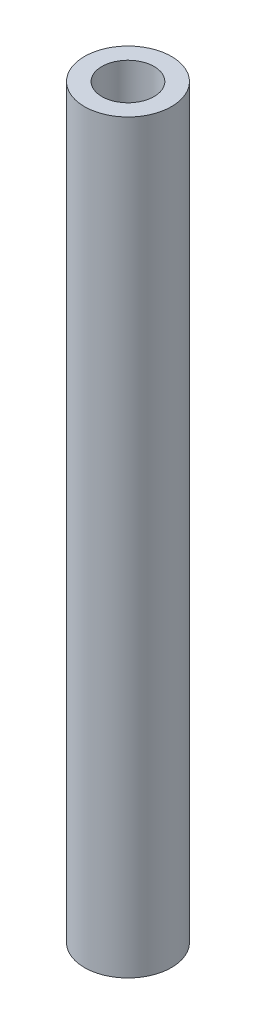
from build123d import *

# Parameters (mm, degrees)
SKETCH_1_R      = 3.5
SKETCH_1_R_2    = 2.1
EXTRUDE_1_DEPTH = 60


with BuildPart() as part:
    # 草图1 → 凸台-拉伸1 (new body)
    with BuildSketch(Plane(origin=(0, 0, 0), x_dir=(1, 0, 0), z_dir=(0, 1, 0))):
        with Locations(Location((0, 0, 0), (0, 0, 270))):
            Circle(SKETCH_1_R)
        with Locations(Location((0, 0, 0), (0, 0, 270))):
            Circle(SKETCH_1_R_2, mode=Mode.SUBTRACT)
    extrude(amount=EXTRUDE_1_DEPTH)


solid = part.part
